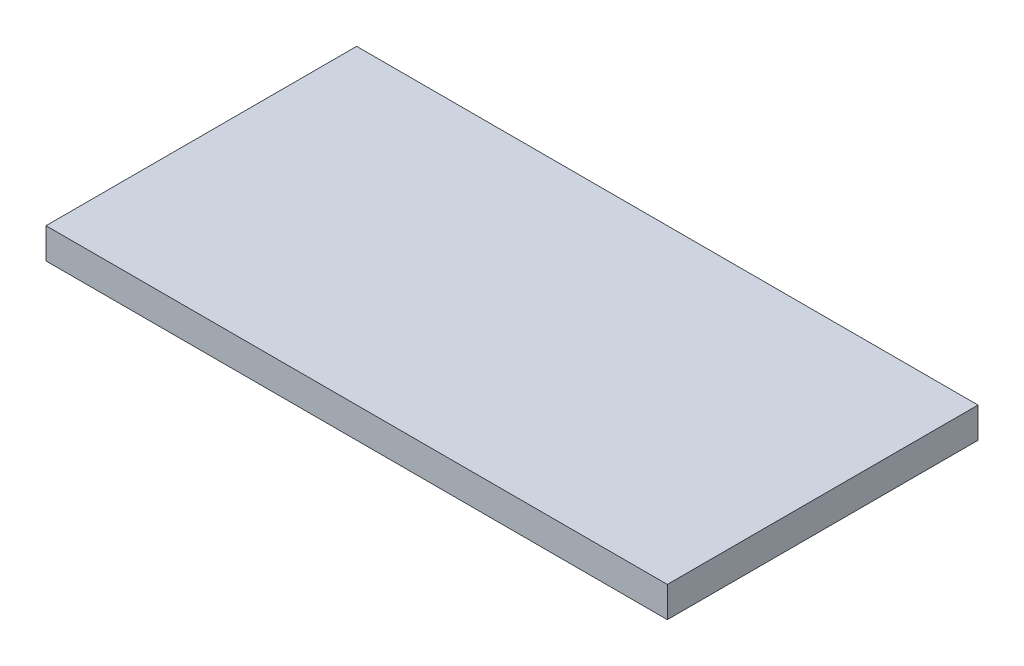
from build123d import *

# Parameters (mm, degrees)
SKETCH1_W      = 1219.2
SKETCH1_H      = 609.6
EXTRUDE1_DEPTH = 59.944


with BuildPart() as part:
    # Sketch1 → Extrude1 (new body)
    with BuildSketch(Plane(origin=(0, 0, 0), x_dir=(1, 0, 0), z_dir=(0, 1, 0))):
        Rectangle(SKETCH1_W, SKETCH1_H)
    extrude(amount=EXTRUDE1_DEPTH)


solid = part.part
